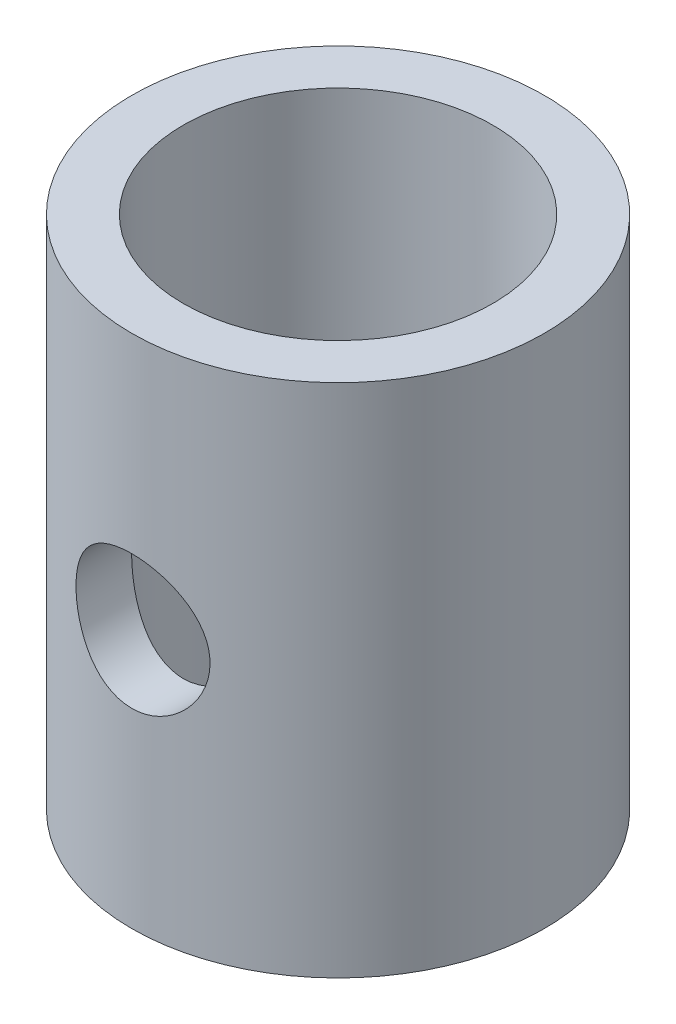
from build123d import *

# Parameters (mm, degrees)
SKETCH1_R               = 2
BOSS_EXTRUDE1_DEPTH     = 5
SKETCH2_R               = 1.5
CUT_EXTRUDE1_DEPTH      = 6.744562647
CUT_EXTRUDE4_DEPTH      = 6.744562647
CUT_EXTRUDE4_DEPTH_BACK = 6.744562647
SKETCH5_R               = 0.65


with BuildPart() as part:
    # Sketch1 → Boss-Extrude1 (new body)
    with BuildSketch(Plane(origin=(0, 0, 0), x_dir=(1, 0, 0), z_dir=(0, 1, 0))):
        with Locations(Location((0, 0, 0), (0, 0, 270))):
            Circle(SKETCH1_R)
    extrude(amount=BOSS_EXTRUDE1_DEPTH)

    # Sketch2 → Cut-Extrude1 (cut, through all)
    with BuildSketch(Plane(origin=(0, 5, 0), x_dir=(1, 0, 0), z_dir=(0, 1, 0))):
        with Locations(Location((0, 0, 0), (0, 0, 270))):
            Circle(SKETCH2_R)
    extrude(amount=-CUT_EXTRUDE1_DEPTH, mode=Mode.SUBTRACT)

    # Sketch5 → Cut-Extrude4 (cut, two sides: drawn at the far end of the back side and taken through both)
    with BuildSketch(Plane.XY.offset(-CUT_EXTRUDE4_DEPTH_BACK)):
        with Locations((0, 2.5)):
            Circle(SKETCH5_R)
    extrude(amount=CUT_EXTRUDE4_DEPTH + CUT_EXTRUDE4_DEPTH_BACK, mode=Mode.SUBTRACT)


solid = part.part
